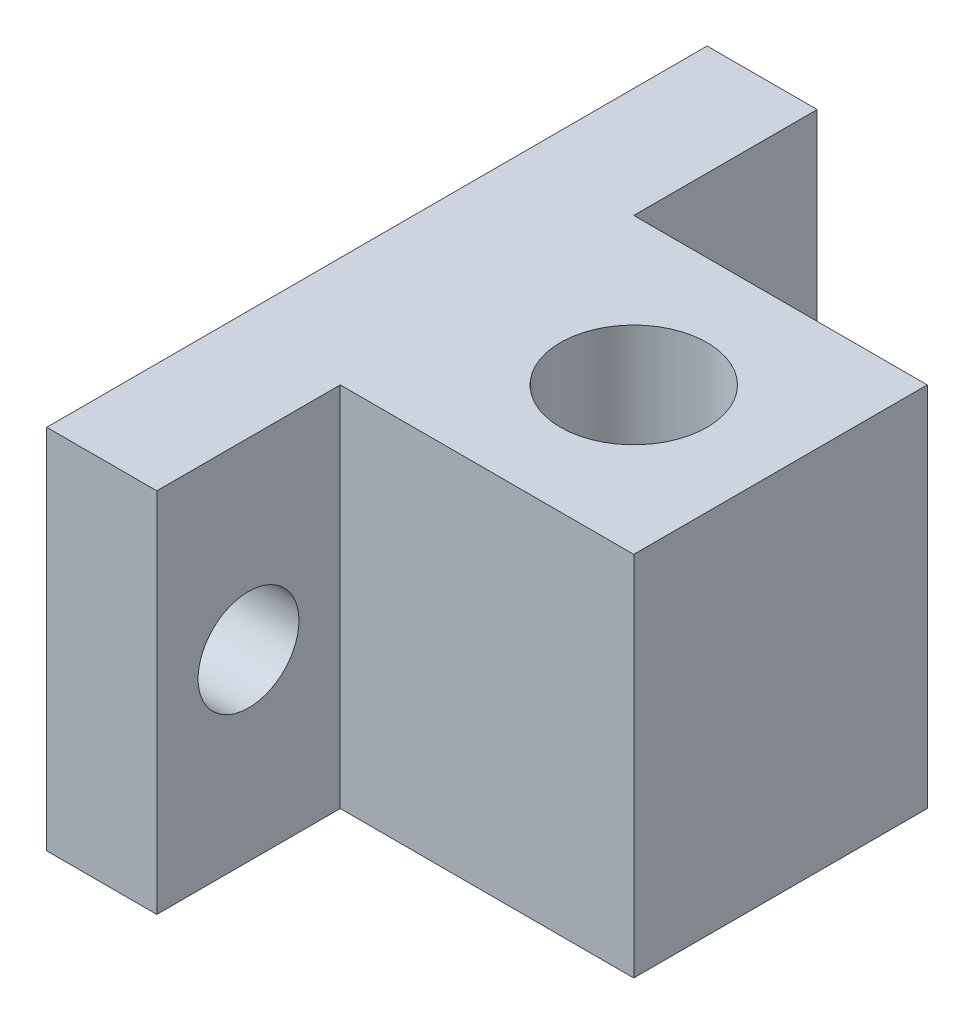
from build123d import *

# Parameters (mm, degrees)
SKETCH1_R           = 4
BOSS_EXTRUDE1_DEPTH = 20
SKETCH2_R           = 2.75
CUT_EXTRUDE1_DEPTH  = 10


with BuildPart() as part:
    # Sketch1 → Boss-Extrude1 (new body)
    with BuildSketch(Plane(origin=(0, 0, 0), x_dir=(1, 0, 0), z_dir=(0, 1, 0))):
        Polygon((0, 0), (0, 36), (6, 36), (6, 26), (22, 26), (22, 10), (6, 10), (6, 0), align=None)
        with Locations(Location((14, 18, 0), (0, 0, 270))):
            Circle(SKETCH1_R, mode=Mode.SUBTRACT)
    extrude(amount=BOSS_EXTRUDE1_DEPTH)

    # Sketch2 → Cut-Extrude1 (cut)
    with BuildSketch(Plane(origin=(6, 0, 0), x_dir=(0, 0, -1), z_dir=(1, 0, 0))):
        with Locations((5, 10)):
            Circle(SKETCH2_R)
        with Locations((31, 10)):
            Circle(SKETCH2_R)
    extrude(amount=-CUT_EXTRUDE1_DEPTH, mode=Mode.SUBTRACT)


solid = part.part
